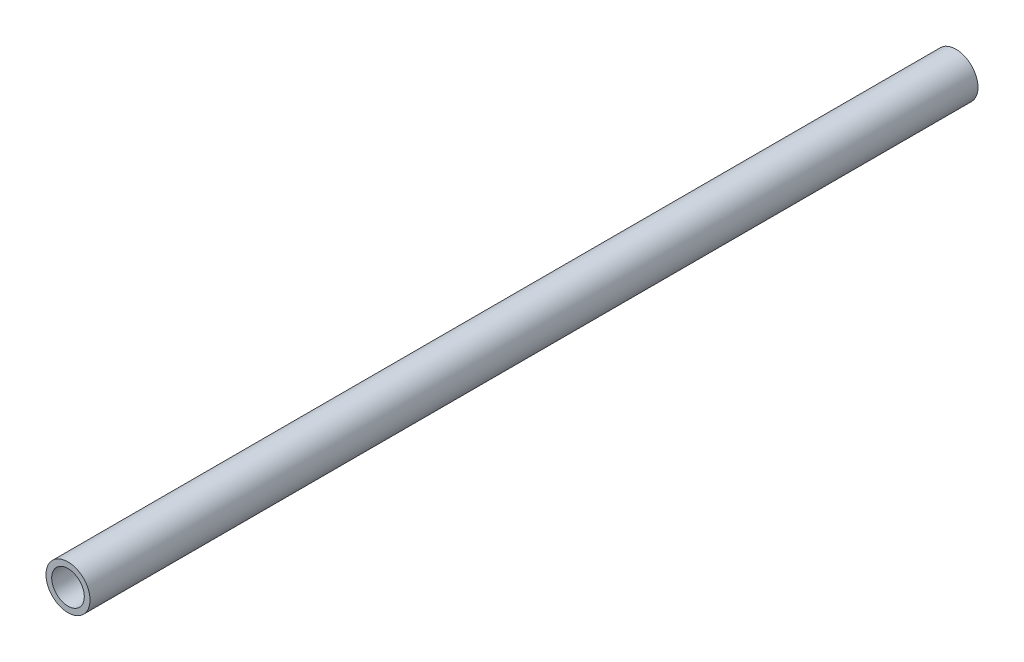
from build123d import *

# Parameters (mm, degrees)
SKETCH1_R           = 10.668
SKETCH1_R_2         = 7.8994
EXTRUDE_THIN1_DEPTH = 215


with BuildPart() as part:
    # Sketch1 → Extrude-Thin1 (new, symmetric)
    with BuildSketch(Plane.XY):
        Circle(SKETCH1_R)
        Circle(SKETCH1_R_2, mode=Mode.SUBTRACT)
    extrude(amount=EXTRUDE_THIN1_DEPTH, both=True)


solid = part.part
